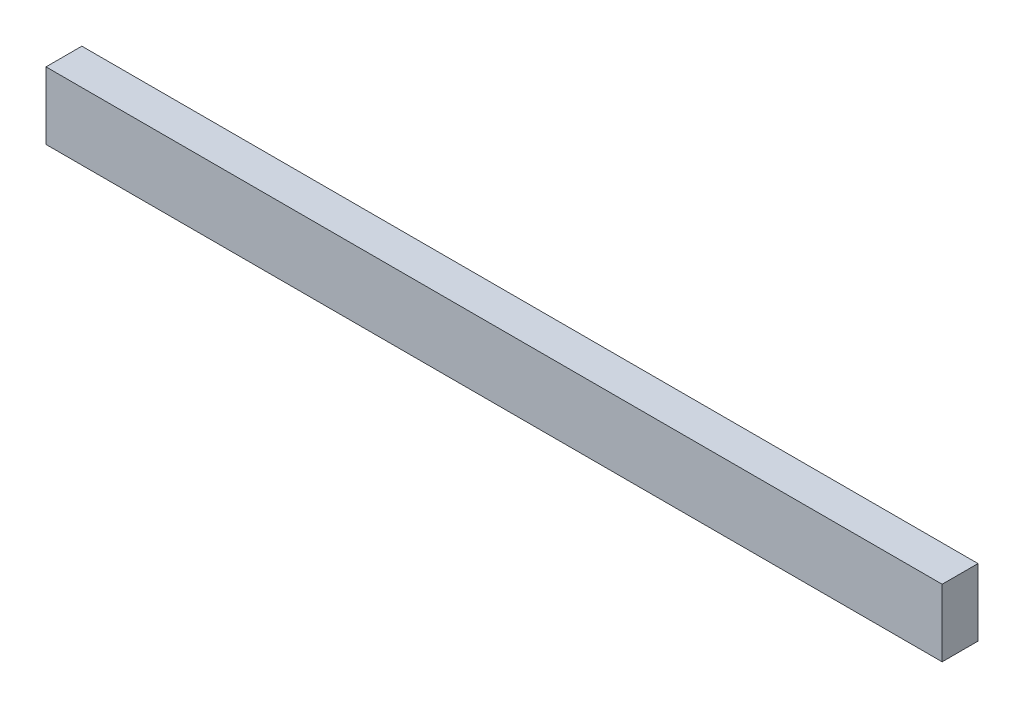
from build123d import *

# Parameters (mm, degrees)
SKETCH1_W           = 250
SKETCH1_H           = 18.75
BOSS_EXTRUDE1_DEPTH = 10


with BuildPart() as part:
    # Sketch1 → Boss-Extrude1 (new body)
    with BuildSketch(Plane.XY):
        Rectangle(SKETCH1_W, SKETCH1_H)
    extrude(amount=BOSS_EXTRUDE1_DEPTH)


solid = part.part
